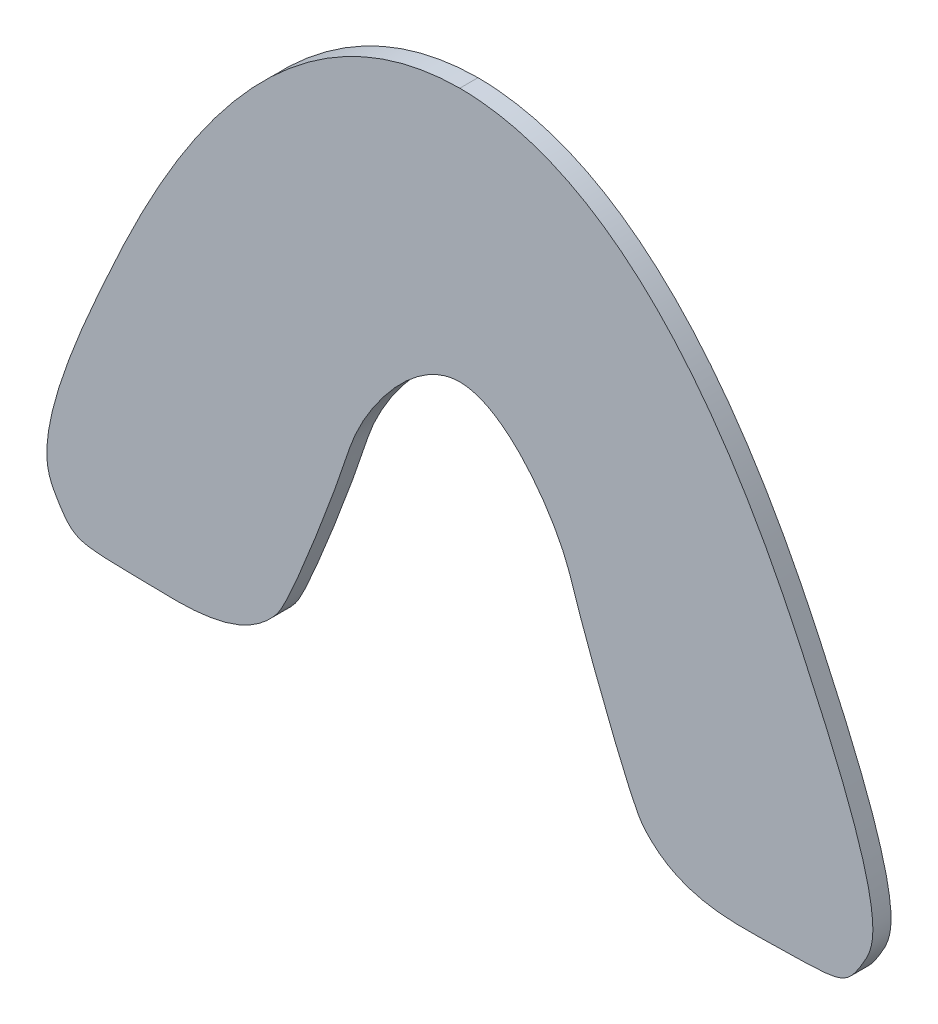
from build123d import *

# Parameters (mm, degrees)
RESSALTO_EXTRUS_O1_DEPTH = 2


with BuildPart() as part:
    # Esboço1 → Ressalto-extrusão1 (new body)
    with BuildSketch(Plane.XY):
        with BuildLine():
            add(Edge.make_bspline(
                [(0, 12), (4.761619014, 11.999995669), (10.851821786, 3.836489549), (13.651485201, -5.28112037), (18.945566804, -18.763887148), (21.314225016, -21.645386748), (24.932153146, -24.683236686), (41.757844982, -24.185169663), (42.484836672, -24.567473872), (46.734525503, -17.118800474), (42.867374232, -6.427851315), (36.430141105, 8.037340575), (21.564453808, 39.858788412), (0, 40)],
                knots=[0.303894497, 0.303894497, 0.303894497, 0.303894497, 0.34947704, 0.361676375, 0.418753245, 0.434216179, 0.500842783, 0.520949139, 0.615173385, 0.635302352, 0.702109843, 0.719804151, 0.803894497, 0.803894497, 0.803894497, 0.803894497], degree=3))
            add(Edge.make_bspline(
                [(0, 12), (-4.761619014, 11.999995669), (-10.851821786, 3.836489549), (-13.651485201, -5.28112037), (-18.945566804, -18.763887148), (-21.314225016, -21.645386748), (-24.932153146, -24.683236686), (-41.757844982, -24.185169663), (-42.484836672, -24.567473872), (-46.734525503, -17.118800474), (-42.867374232, -6.427851315), (-36.430141105, 8.037340575), (-21.564453808, 39.858788412), (0, 40)],
                knots=[0.303894497, 0.303894497, 0.303894497, 0.303894497, 0.34947704, 0.361676375, 0.418753245, 0.434216179, 0.500842783, 0.520949139, 0.615173385, 0.635302352, 0.702109843, 0.719804151, 0.803894497, 0.803894497, 0.803894497, 0.803894497], degree=3))
        make_face()
    extrude(amount=RESSALTO_EXTRUS_O1_DEPTH)


solid = part.part
